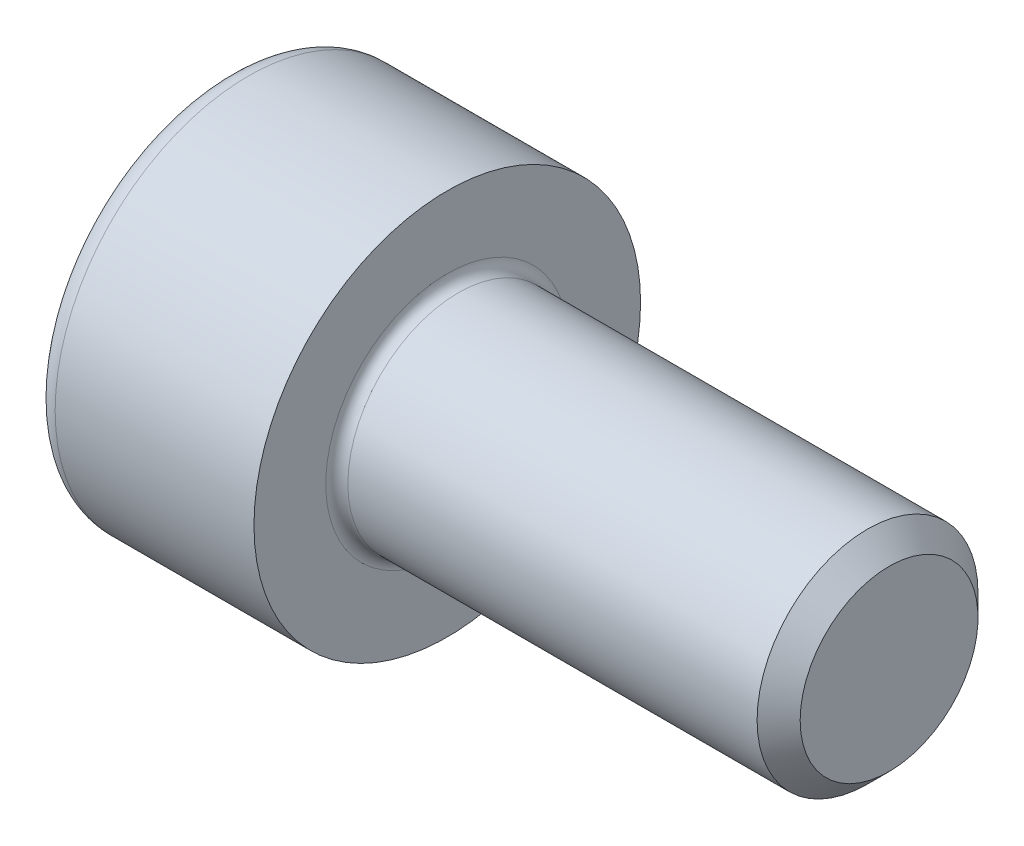
from build123d import *

# Parameters (mm, degrees)
FILLET1_R   = 0.2
FILLET2_R   = 0.4
HEX_2_DEPTH = 2


with BuildPart() as part:
    # BodySke → Base-Revolve (revolve)
    with BuildSketch(Plane.XY, mode=Mode.PRIVATE) as base_revolve_sk:
        Polygon((0, 0), (0, 3.5), (4, 3.5), (4, 2), (11.61, 2), (12, 1.61), (12, 0), align=None)
    revolve(base_revolve_sk.sketch.rotate(Axis((-31.75, 0, 0), (1, 0, 0)), 90), axis=Axis((-31.75, 0, 0), (1, 0, 0)))

    # Fillet1
    fillet1_edges = [part.edges().sort_by_distance(p)[0] for p in [
        (4, 0, -2),
    ]]
    fillet(fillet1_edges, radius=FILLET1_R)

    # Fillet2
    fillet2_edges = [part.edges().sort_by_distance(p)[0] for p in [
        (0, 0, -3.5),
    ]]
    fillet(fillet2_edges, radius=FILLET2_R)

    # Sketch2 → Hex-PreBroach (revolve, cut)
    with BuildSketch(Plane.XY, mode=Mode.PRIVATE) as hex_prebroach_sk:
        Polygon((0, 1.51), (2, 1.51), (2.871798906, 0), (0, 0), align=None)
    revolve(hex_prebroach_sk.sketch.rotate(Axis((0, 0, 0), (1, 0, 0)), 90), axis=Axis((0, 0, 0), (1, 0, 0)), mode=Mode.SUBTRACT)

    # Sketch3 → Hex 2 (cut)
    with BuildSketch(Plane(origin=(0, 0, 0), x_dir=(0, 0.500000000000001, 0.866025403784438), z_dir=(-1, 0, 0))):
        Polygon((0.871798906, 1.51), (-0.871798906, 1.51), (-1.743597813, 0), (-0.871798906, -1.51), (0.871798906, -1.51), (1.743597813, 0), align=None)
    extrude(amount=-HEX_2_DEPTH, mode=Mode.SUBTRACT)


solid = part.part
